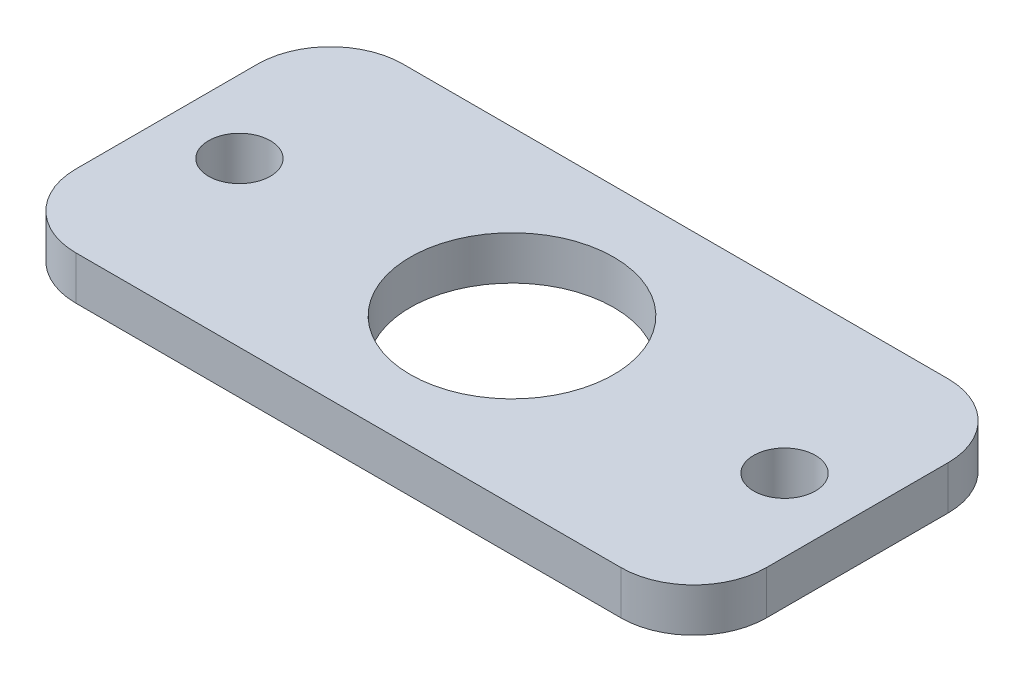
from build123d import *

# Parameters (mm, degrees)
SKETCH1_W           = 95
SKETCH1_H           = 45
SKETCH1_R           = 14
SKETCH1_R_2         = 4.25
BOSS_EXTRUDE1_DEPTH = 6
FILLET1_R           = 10


with BuildPart() as part:
    # Sketch1 → Boss-Extrude1 (new body)
    with BuildSketch(Plane(origin=(0, 0, 0), x_dir=(1, 0, 0), z_dir=(0, 1, 0))):
        Rectangle(SKETCH1_W, SKETCH1_H)
        with Locations(Location((0, 0, 0), (0, 0, 270))):
            Circle(SKETCH1_R, mode=Mode.SUBTRACT)
        with Locations(Location((37.5, 0, 0), (0, 0, 270))):
            Circle(SKETCH1_R_2, mode=Mode.SUBTRACT)
        with Locations(Location((-37.5, 0, 0), (0, 0, 90))):
            Circle(SKETCH1_R_2, mode=Mode.SUBTRACT)
    extrude(amount=BOSS_EXTRUDE1_DEPTH)

    # Fillet1
    fillet1_edges = [part.edges().sort_by_distance(p)[0] for p in [
        (47.5, 3, 22.5),
        (-47.5, 3, 22.5),
        (-47.5, 3, -22.5),
        (47.5, 3, -22.5),
    ]]
    fillet(fillet1_edges, radius=FILLET1_R)


solid = part.part
